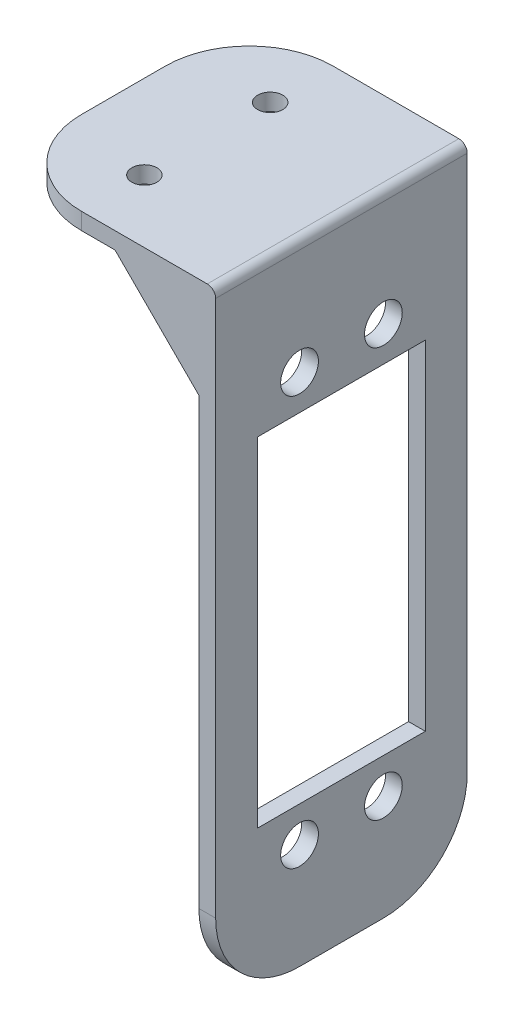
from build123d import *

# Parameters (mm, degrees)
SKETCH1_W           = 25
SKETCH1_H           = 30
SKETCH1_R           = 1.5
BOSS_EXTRUDE1_DEPTH = 2
BOSS_EXTRUDE2_DEPTH = 75
FILLET1_R           = 1
SKETCH3_R           = 2.25
SKETCH3_W           = 0.5
SKETCH3_H           = 6.8
CUT_EXTRUDE1_DEPTH  = 75
SKETCH5_W           = 1
SKETCH5_H           = 6.8
BOSS_EXTRUDE3_DEPTH = 2
FILLET2_R           = 10
BOSS_EXTRUDE4_DEPTH = 2


with BuildPart() as part:
    # Sketch1 → Boss-Extrude1 (new body)
    with BuildSketch(Plane(origin=(0, 0, 0), x_dir=(1, 0, 0), z_dir=(0, 1, 0))):
        with Locations((12.5, 15)):
            Rectangle(SKETCH1_W, SKETCH1_H)
        with Locations(Location((10, 22.5, 0), (0, 0, 270))):
            Circle(SKETCH1_R, mode=Mode.SUBTRACT)
        with Locations(Location((10, 7.5, 0), (0, 0, 270))):
            Circle(SKETCH1_R, mode=Mode.SUBTRACT)
    extrude(amount=BOSS_EXTRUDE1_DEPTH)

    # Sketch2 → Boss-Extrude2 (add)
    with BuildSketch(Plane(origin=(0, 2, 0), x_dir=(1, 0, 0), z_dir=(0, 1, 0))):
        Polygon((25, 30), (24, 30), (24, 0), (25, 0), (26, 0), (26, 30), align=None)
    extrude(amount=-BOSS_EXTRUDE2_DEPTH)

    # Fillet1
    fillet1_edges = [part.edges().sort_by_distance(p)[0] for p in [
        (26, 2, -15),
        (24, 0, -15),
    ]]
    fillet(fillet1_edges, radius=FILLET1_R)

    # Sketch3 → Cut-Extrude1 (cut)
    with BuildSketch(Plane.ZY.offset(-24)):
        with Locations((-20, -60.4)):
            Circle(SKETCH3_R)
        Polygon((-15, -56.2), (-15, -15.8), (-15.5, -15.8), (-25, -15.8), (-25, -56.2), (-15.5, -56.2), align=None)
        with Locations((-10, -60.4)):
            Circle(SKETCH3_R)
        with Locations((-15.25, -59.6)):
            Rectangle(SKETCH3_W, SKETCH3_H)
        with Locations((-14.75, -59.6)):
            Rectangle(SKETCH3_W, SKETCH3_H)
        Polygon((-14.5, -15.8), (-15, -15.8), (-15, -56.2), (-14.5, -56.2), (-5, -56.2), (-5, -15.8), align=None)
        with Locations((-10, -11.6)):
            Circle(SKETCH3_R)
        with Locations((-20, -11.6)):
            Circle(SKETCH3_R)
        with Locations((-15.25, -12.4)):
            Rectangle(SKETCH3_W, SKETCH3_H)
        with Locations((-14.75, -12.4)):
            Rectangle(SKETCH3_W, SKETCH3_H)
    extrude(amount=-CUT_EXTRUDE1_DEPTH, mode=Mode.SUBTRACT)

    # Sketch5 → Boss-Extrude3 (add)
    with BuildSketch(Plane(origin=(26, 0, 0), x_dir=(0, 0, -1), z_dir=(1, 0, 0))):
        with Locations((15, -12.4)):
            Rectangle(SKETCH5_W, SKETCH5_H)
        with Locations((15, -59.6)):
            Rectangle(SKETCH5_W, SKETCH5_H)
    extrude(amount=-BOSS_EXTRUDE3_DEPTH)

    # Fillet2
    fillet2_edges = [part.edges().sort_by_distance(p)[0] for p in [
        (25, -73, 0),
        (25, -73, -30),
        (0, 1, -30),
        (0, 1, 0),
    ]]
    fillet(fillet2_edges, radius=FILLET2_R)

    # Sketch8 → Boss-Extrude4 (add)
    with BuildSketch(Plane.XY):
        with BuildLine():
            Line((23, 0), (14, 0))
            Line((14, 0), (24, -10))
            Line((24, -10), (24, -1))
            ThreePointArc((24, -1), (23.707106781, -0.292893219), (23, 0))
        make_face()
    boss_extrude4 = extrude(amount=-BOSS_EXTRUDE4_DEPTH)

    # Mirror1: Boss-Extrude4 across plane
    add(boss_extrude4.mirror(Plane.XY.offset(-15)))


solid = part.part
